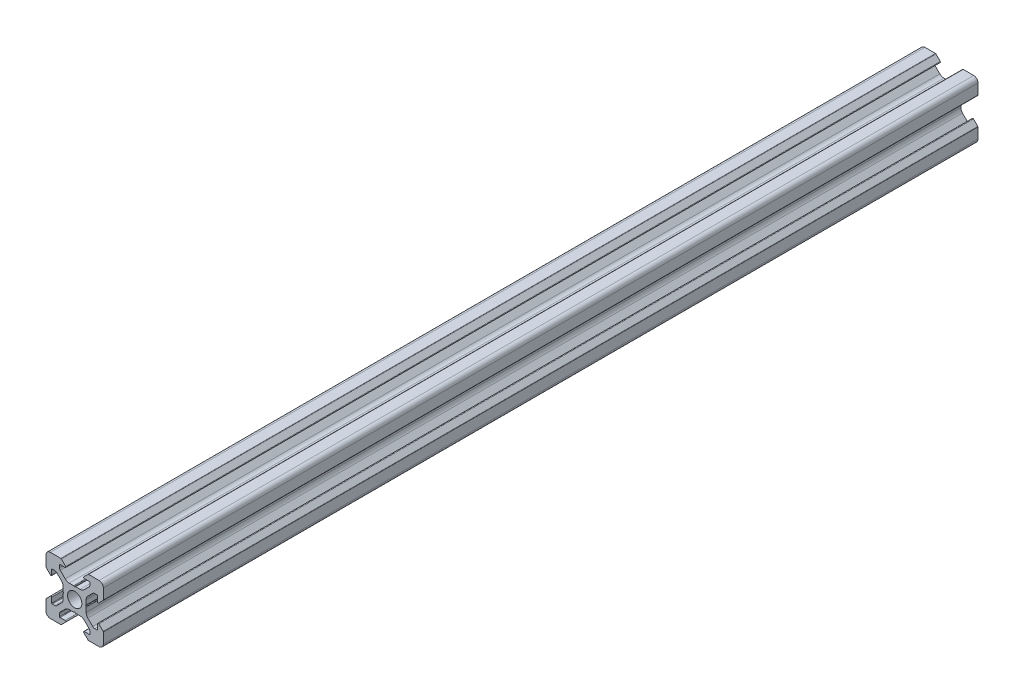
from build123d import *

# Parameters (mm, degrees)
MODEL_R         = 2.5
EXTRUDE_1_DEPTH = 305


with BuildPart() as part:
    # Model → Бобышка-Вытянуть1 (new body)
    with BuildSketch(Plane.XY):
        with BuildLine():
            Line((18.94214915, 33.362214718), (18.94214915, 34.923300122))
            ThreePointArc((18.94214915, 34.923300122), (18.789908215, 35.688666987), (18.356362712, 36.337513684))
            Line((18.356362712, 36.337513684), (16.662250163, 38.031626234))
            ThreePointArc((16.662250163, 38.031626234), (16.337826814, 38.248398985), (15.955143382, 38.324519453))
            Line((15.955143382, 38.324519453), (15.14214915, 38.324519453))
            ThreePointArc((15.14214915, 38.324519453), (15.000727794, 38.265940809), (14.94214915, 38.124519453))
            Line((14.94214915, 38.124519453), (14.94214915, 36.354519453))
            ThreePointArc((14.94214915, 36.354519453), (14.787820008, 36.12354957), (14.515372455, 36.177742757))
            Line((14.515372455, 36.177742757), (13.015372455, 37.677742757))
            ThreePointArc((13.015372455, 37.677742757), (12.961179267, 37.758848595), (12.94214915, 37.854519453))
            Line((12.94214915, 37.854519453), (12.94214915, 41.524519453))
            ThreePointArc((12.94214915, 41.524519453), (13.381488978, 42.585179625), (14.44214915, 43.024519453))
            Line((14.44214915, 43.024519453), (18.11214915, 43.024519453))
            ThreePointArc((18.11214915, 43.024519453), (18.207820008, 43.005489336), (18.288925845, 42.951296148))
            Line((18.288925845, 42.951296148), (19.788925845, 41.451296148))
            ThreePointArc((19.788925845, 41.451296148), (19.843119033, 41.178848595), (19.61214915, 41.024519453))
            Line((19.61214915, 41.024519453), (17.84214915, 41.024519453))
            ThreePointArc((17.84214915, 41.024519453), (17.700727794, 40.965940809), (17.64214915, 40.824519453))
            Line((17.64214915, 40.824519453), (17.64214915, 40.011525221))
            ThreePointArc((17.64214915, 40.011525221), (17.718269617, 39.628841789), (17.935042369, 39.30441844))
            Line((17.935042369, 39.30441844), (19.629154919, 37.61030589))
            ThreePointArc((19.629154919, 37.61030589), (20.278001616, 37.176760388), (21.043368481, 37.024519453))
            Line((21.043368481, 37.024519453), (22.604453885, 37.024519453))
            ThreePointArc((22.604453885, 37.024519453), (22.687205621, 37.010426533), (22.760627647, 36.969736655))
            Line((22.760627647, 36.969736655), (22.94214915, 36.824519453))
            Line((22.94214915, 36.824519453), (23.123670653, 36.969736655))
            ThreePointArc((23.123670653, 36.969736655), (23.197092679, 37.010426533), (23.279844415, 37.024519453))
            Line((23.279844415, 37.024519453), (24.840929819, 37.024519453))
            ThreePointArc((24.840929819, 37.024519453), (25.606296684, 37.176760388), (26.255143382, 37.61030589))
            Line((26.255143382, 37.61030589), (27.949255931, 39.30441844))
            ThreePointArc((27.949255931, 39.30441844), (28.166028683, 39.628841789), (28.24214915, 40.011525221))
            Line((28.24214915, 40.011525221), (28.24214915, 40.824519453))
            ThreePointArc((28.24214915, 40.824519453), (28.183570506, 40.965940809), (28.04214915, 41.024519453))
            Line((28.04214915, 41.024519453), (26.27214915, 41.024519453))
            ThreePointArc((26.27214915, 41.024519453), (26.041179267, 41.178848595), (26.095372455, 41.451296148))
            Line((26.095372455, 41.451296148), (27.595372455, 42.951296148))
            ThreePointArc((27.595372455, 42.951296148), (27.676478292, 43.005489336), (27.77214915, 43.024519453))
            Line((27.77214915, 43.024519453), (31.44214915, 43.024519453))
            ThreePointArc((31.44214915, 43.024519453), (32.502809322, 42.585179625), (32.94214915, 41.524519453))
            Line((32.94214915, 41.524519453), (32.94214915, 37.854519453))
            ThreePointArc((32.94214915, 37.854519453), (32.923119033, 37.758848595), (32.868925845, 37.677742757))
            Line((32.868925845, 37.677742757), (31.368925845, 36.177742757))
            ThreePointArc((31.368925845, 36.177742757), (31.096478292, 36.12354957), (30.94214915, 36.354519453))
            Line((30.94214915, 36.354519453), (30.94214915, 38.124519453))
            ThreePointArc((30.94214915, 38.124519453), (30.883570506, 38.265940809), (30.74214915, 38.324519453))
            Line((30.74214915, 38.324519453), (29.929154919, 38.324519453))
            ThreePointArc((29.929154919, 38.324519453), (29.546471486, 38.248398985), (29.222048137, 38.031626234))
            Line((29.222048137, 38.031626234), (27.527935588, 36.337513684))
            ThreePointArc((27.527935588, 36.337513684), (27.094390085, 35.688666987), (26.94214915, 34.923300122))
            Line((26.94214915, 34.923300122), (26.94214915, 33.362214718))
            ThreePointArc((26.94214915, 33.362214718), (26.92805623, 33.279462982), (26.887366352, 33.206040956))
            Line((26.887366352, 33.206040956), (26.74214915, 33.024519453))
            Line((26.74214915, 33.024519453), (26.887366352, 32.84299795))
            ThreePointArc((26.887366352, 32.84299795), (26.92805623, 32.769575923), (26.94214915, 32.686824188))
            Line((26.94214915, 32.686824188), (26.94214915, 31.125738784))
            ThreePointArc((26.94214915, 31.125738784), (27.094390085, 30.360371919), (27.527935588, 29.711525221))
            Line((27.527935588, 29.711525221), (29.222048137, 28.017412672))
            ThreePointArc((29.222048137, 28.017412672), (29.546471486, 27.80063992), (29.929154919, 27.724519453))
            Line((29.929154919, 27.724519453), (30.74214915, 27.724519453))
            ThreePointArc((30.74214915, 27.724519453), (30.883570506, 27.783098097), (30.94214915, 27.924519453))
            Line((30.94214915, 27.924519453), (30.94214915, 29.694519453))
            ThreePointArc((30.94214915, 29.694519453), (31.096478292, 29.925489336), (31.368925845, 29.871296148))
            Line((31.368925845, 29.871296148), (32.868925845, 28.371296148))
            ThreePointArc((32.868925845, 28.371296148), (32.923119033, 28.290190311), (32.94214915, 28.194519453))
            Line((32.94214915, 28.194519453), (32.94214915, 24.524519453))
            ThreePointArc((32.94214915, 24.524519453), (32.502809322, 23.463859281), (31.44214915, 23.024519453))
            Line((31.44214915, 23.024519453), (27.77214915, 23.024519453))
            ThreePointArc((27.77214915, 23.024519453), (27.676478292, 23.04354957), (27.595372455, 23.097742757))
            Line((27.595372455, 23.097742757), (26.095372455, 24.597742757))
            ThreePointArc((26.095372455, 24.597742757), (26.041179267, 24.870190311), (26.27214915, 25.024519453))
            Line((26.27214915, 25.024519453), (28.04214915, 25.024519453))
            ThreePointArc((28.04214915, 25.024519453), (28.183570506, 25.083098097), (28.24214915, 25.224519453))
            Line((28.24214915, 25.224519453), (28.24214915, 26.037513684))
            ThreePointArc((28.24214915, 26.037513684), (28.166028683, 26.420197117), (27.949255931, 26.744620465))
            Line((27.949255931, 26.744620465), (26.255143382, 28.438733015))
            ThreePointArc((26.255143382, 28.438733015), (25.606296684, 28.872278518), (24.840929819, 29.024519453))
            Line((24.840929819, 29.024519453), (23.279844415, 29.024519453))
            ThreePointArc((23.279844415, 29.024519453), (23.197092679, 29.038612373), (23.123670653, 29.07930225))
            Line((23.123670653, 29.07930225), (22.94214915, 29.224519453))
            Line((22.94214915, 29.224519453), (22.760627647, 29.07930225))
            ThreePointArc((22.760627647, 29.07930225), (22.687205621, 29.038612373), (22.604453885, 29.024519453))
            Line((22.604453885, 29.024519453), (21.043368481, 29.024519453))
            ThreePointArc((21.043368481, 29.024519453), (20.278001616, 28.872278518), (19.629154919, 28.438733015))
            Line((19.629154919, 28.438733015), (17.935042369, 26.744620465))
            ThreePointArc((17.935042369, 26.744620465), (17.718269617, 26.420197117), (17.64214915, 26.037513684))
            Line((17.64214915, 26.037513684), (17.64214915, 25.224519453))
            ThreePointArc((17.64214915, 25.224519453), (17.700727794, 25.083098097), (17.84214915, 25.024519453))
            Line((17.84214915, 25.024519453), (19.61214915, 25.024519453))
            ThreePointArc((19.61214915, 25.024519453), (19.843119033, 24.870190311), (19.788925845, 24.597742757))
            Line((19.788925845, 24.597742757), (18.288925845, 23.097742757))
            ThreePointArc((18.288925845, 23.097742757), (18.207820008, 23.04354957), (18.11214915, 23.024519453))
            Line((18.11214915, 23.024519453), (14.44214915, 23.024519453))
            ThreePointArc((14.44214915, 23.024519453), (13.381488978, 23.463859281), (12.94214915, 24.524519453))
            Line((12.94214915, 24.524519453), (12.94214915, 28.194519453))
            ThreePointArc((12.94214915, 28.194519453), (12.961179267, 28.290190311), (13.015372455, 28.371296148))
            Line((13.015372455, 28.371296148), (14.515372455, 29.871296148))
            ThreePointArc((14.515372455, 29.871296148), (14.787820008, 29.925489336), (14.94214915, 29.694519453))
            Line((14.94214915, 29.694519453), (14.94214915, 27.924519453))
            ThreePointArc((14.94214915, 27.924519453), (15.000727794, 27.783098097), (15.14214915, 27.724519453))
            Line((15.14214915, 27.724519453), (15.955143382, 27.724519453))
            ThreePointArc((15.955143382, 27.724519453), (16.337826814, 27.80063992), (16.662250163, 28.017412672))
            Line((16.662250163, 28.017412672), (18.356362712, 29.711525221))
            ThreePointArc((18.356362712, 29.711525221), (18.789908215, 30.360371919), (18.94214915, 31.125738784))
            Line((18.94214915, 31.125738784), (18.94214915, 32.686824188))
            ThreePointArc((18.94214915, 32.686824188), (18.95624207, 32.769575923), (18.996931948, 32.84299795))
            Line((18.996931948, 32.84299795), (19.14214915, 33.024519453))
            Line((19.14214915, 33.024519453), (18.996931948, 33.206040956))
            ThreePointArc((18.996931948, 33.206040956), (18.95624207, 33.279462982), (18.94214915, 33.362214718))
        make_face()
        with Locations((22.94214915, 33.024519453)):
            Circle(MODEL_R, mode=Mode.SUBTRACT)
    extrude(amount=EXTRUDE_1_DEPTH)


solid = part.part
